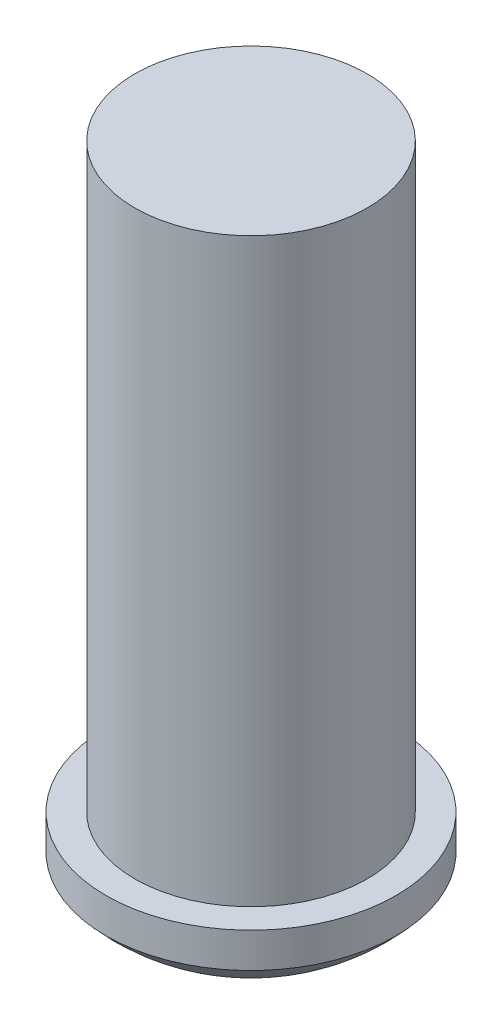
from build123d import *

# Parameters (mm, degrees)
SKETCH_1_R      = 1
EXTRUDE_1_DEPTH = 5


with BuildPart() as part:
    # 草图1 → 凸台-拉伸1 (new body)
    with BuildSketch(Plane(origin=(0, 0, 0), x_dir=(1, 0, 0), z_dir=(0, 1, 0))):
        with Locations(Location((0, 0, 0), (0, 0, 270))):
            Circle(SKETCH_1_R)
    extrude(amount=EXTRUDE_1_DEPTH)

    # 草图5 → 旋转1 (revolve)
    with BuildSketch(Plane.XY, mode=Mode.PRIVATE) as revolve_1_sk:
        with BuildLine():
            Line((0, 0), (0, -0.803737915))
            add(Edge.make_bspline(
                [(0, -0.803737915), (-0.759268596, -0.856933587), (-1.247184997, -0.300388251)],
                knots=[0, 0, 0, 1, 1, 1], degree=2))
            Line((-1.247184997, -0.300388251), (-1.247184997, 0))
            Line((-1.247184997, 0), (0, 0))
        make_face()
    revolve(revolve_1_sk.sketch.rotate(Axis((0, 0, 0), (0, -1, 0)), 270), axis=Axis((0, 0, 0), (0, -1, 0)))


solid = part.part
